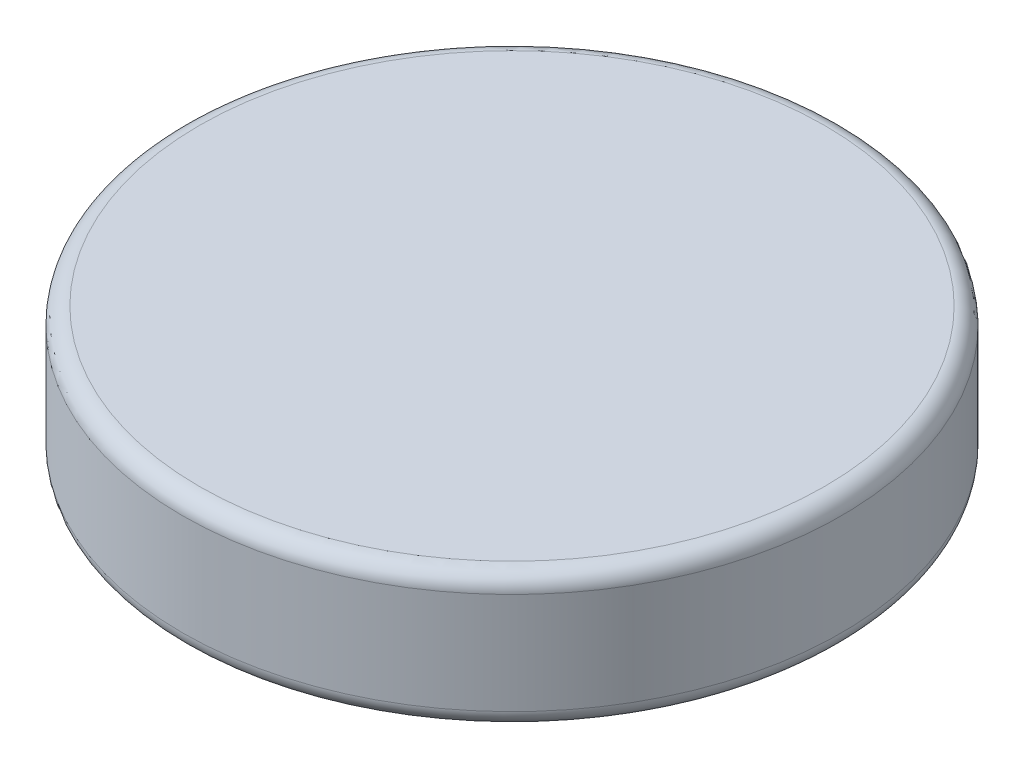
from build123d import *

# Parameters (mm, degrees)
SKETCH1_R           = 4.953
BOSS_EXTRUDE1_DEPTH = 2.032
FILLET1_R           = 0.254


with BuildPart() as part:
    # Sketch1 → Boss-Extrude1 (new body)
    with BuildSketch(Plane(origin=(0, 0, 0), x_dir=(1, 0, 0), z_dir=(0, 1, 0))):
        with Locations(Location((0, 0, 0), (0, 0, 270))):
            Circle(SKETCH1_R)
    extrude(amount=BOSS_EXTRUDE1_DEPTH)

    # Fillet1
    fillet1_edges = [part.edges().sort_by_distance(p)[0] for p in [
        (0, 0, -4.953),
        (0, 2.032, -4.953),
    ]]
    fillet(fillet1_edges, radius=FILLET1_R)


solid = part.part
